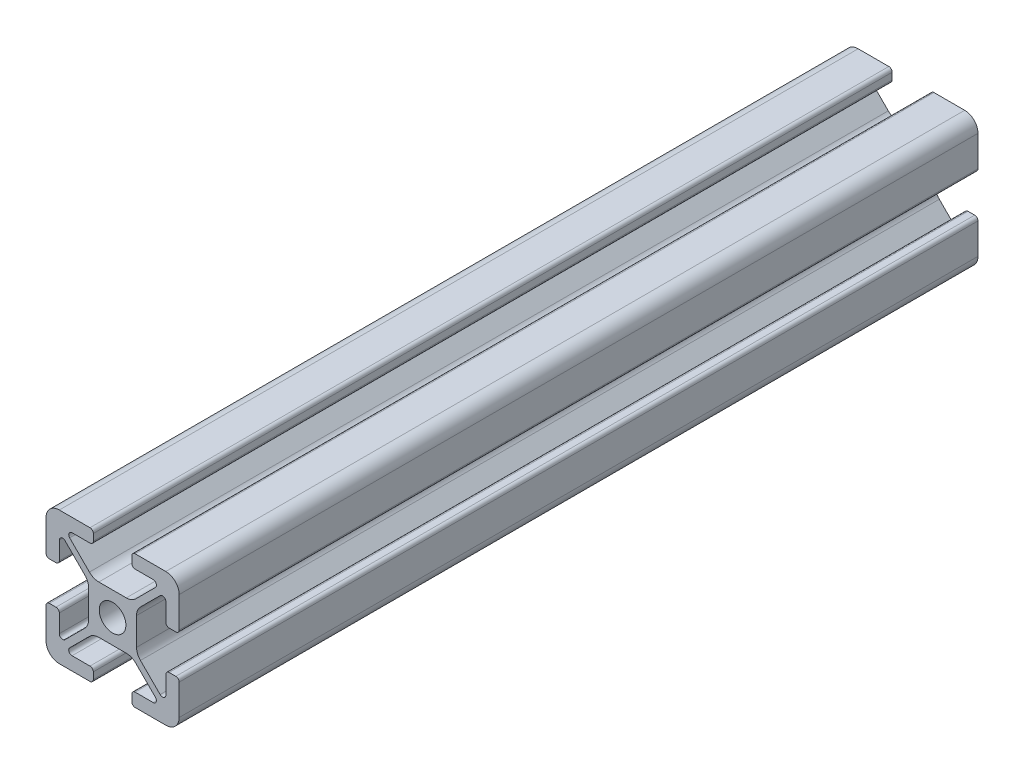
from build123d import *

# Parameters (mm, degrees)
SKETCH1_R           = 2.54
BOSS_EXTRUDE1_DEPTH = 152.4


with BuildPart() as part:
    # Sketch1 → Boss-Extrude1 (new body)
    with BuildSketch(Plane.XY):
        with BuildLine():
            Line((4.417923164, 5.315948776), (8.177961582, 9.075987194))
            ThreePointArc((8.177961582, 9.075987194), (8.315612279, 9.76800398), (7.728948776, 10.16))
            Line((7.728948776, 10.16), (4.308974388, 10.16))
            ThreePointArc((4.308974388, 10.16), (3.859961582, 10.345987194), (3.673974388, 10.795))
            Line((3.673974388, 10.795), (3.673974388, 12.065))
            ThreePointArc((3.673974388, 12.065), (3.859961582, 12.514012806), (4.308974388, 12.7))
            Line((4.308974388, 12.7), (10.16, 12.7))
            ThreePointArc((10.16, 12.7), (11.956051224, 11.956051224), (12.7, 10.16))
            Line((12.7, 10.16), (12.7, 4.308974388))
            ThreePointArc((12.7, 4.308974388), (12.514012806, 3.859961582), (12.065, 3.673974388))
            Line((12.065, 3.673974388), (10.795, 3.673974388))
            ThreePointArc((10.795, 3.673974388), (10.345987194, 3.859961582), (10.16, 4.308974388))
            Line((10.16, 4.308974388), (10.16, 7.728948776))
            ThreePointArc((10.16, 7.728948776), (9.76800398, 8.315612279), (9.075987194, 8.177961582))
            Line((9.075987194, 8.177961582), (5.315948776, 4.417923164))
            ThreePointArc((5.315948776, 4.417923164), (4.765345987, 3.593887858), (4.572, 2.621871939))
            Line((4.572, 2.621871939), (4.572, -2.621871939))
            ThreePointArc((4.572, -2.621871939), (4.765345987, -3.593887858), (5.315948776, -4.417923164))
            Line((5.315948776, -4.417923164), (9.075987194, -8.177961582))
            ThreePointArc((9.075987194, -8.177961582), (9.76800398, -8.315612279), (10.16, -7.728948776))
            Line((10.16, -7.728948776), (10.16, -4.308974388))
            ThreePointArc((10.16, -4.308974388), (10.345987194, -3.859961582), (10.795, -3.673974388))
            Line((10.795, -3.673974388), (12.065, -3.673974388))
            ThreePointArc((12.065, -3.673974388), (12.514012806, -3.859961582), (12.7, -4.308974388))
            Line((12.7, -4.308974388), (12.7, -10.16))
            ThreePointArc((12.7, -10.16), (11.956051224, -11.956051224), (10.16, -12.7))
            Line((10.16, -12.7), (4.308974388, -12.7))
            ThreePointArc((4.308974388, -12.7), (3.859961582, -12.514012806), (3.673974388, -12.065))
            Line((3.673974388, -12.065), (3.673974388, -10.795))
            ThreePointArc((3.673974388, -10.795), (3.859961582, -10.345987194), (4.308974388, -10.16))
            Line((4.308974388, -10.16), (7.728948776, -10.16))
            ThreePointArc((7.728948776, -10.16), (8.315612279, -9.76800398), (8.177961582, -9.075987194))
            Line((8.177961582, -9.075987194), (4.417923164, -5.315948776))
            ThreePointArc((4.417923164, -5.315948776), (3.593887858, -4.765345987), (2.621871939, -4.572))
            Line((2.621871939, -4.572), (-2.621871939, -4.572))
            ThreePointArc((-2.621871939, -4.572), (-3.593887858, -4.765345987), (-4.417923164, -5.315948776))
            Line((-4.417923164, -5.315948776), (-8.177961582, -9.075987194))
            ThreePointArc((-8.177961582, -9.075987194), (-8.315612279, -9.76800398), (-7.728948776, -10.16))
            Line((-7.728948776, -10.16), (-4.308974388, -10.16))
            ThreePointArc((-4.308974388, -10.16), (-3.859961582, -10.345987194), (-3.673974388, -10.795))
            Line((-3.673974388, -10.795), (-3.673974388, -12.065))
            ThreePointArc((-3.673974388, -12.065), (-3.859961582, -12.514012806), (-4.308974388, -12.7))
            Line((-4.308974388, -12.7), (-10.16, -12.7))
            ThreePointArc((-10.16, -12.7), (-11.956051224, -11.956051224), (-12.7, -10.16))
            Line((-12.7, -10.16), (-12.7, -4.308974388))
            ThreePointArc((-12.7, -4.308974388), (-12.514012806, -3.859961582), (-12.065, -3.673974388))
            Line((-12.065, -3.673974388), (-10.795, -3.673974388))
            ThreePointArc((-10.795, -3.673974388), (-10.345987194, -3.859961582), (-10.16, -4.308974388))
            Line((-10.16, -4.308974388), (-10.16, -7.728948776))
            ThreePointArc((-10.16, -7.728948776), (-9.76800398, -8.315612279), (-9.075987194, -8.177961582))
            Line((-9.075987194, -8.177961582), (-5.315948776, -4.417923164))
            ThreePointArc((-5.315948776, -4.417923164), (-4.765345987, -3.593887858), (-4.572, -2.621871939))
            Line((-4.572, -2.621871939), (-4.572, 2.621871939))
            ThreePointArc((-4.572, 2.621871939), (-4.765345987, 3.593887858), (-5.315948776, 4.417923164))
            Line((-5.315948776, 4.417923164), (-9.075987194, 8.177961582))
            ThreePointArc((-9.075987194, 8.177961582), (-9.76800398, 8.315612279), (-10.16, 7.728948776))
            Line((-10.16, 7.728948776), (-10.16, 4.308974388))
            ThreePointArc((-10.16, 4.308974388), (-10.345987194, 3.859961582), (-10.795, 3.673974388))
            Line((-10.795, 3.673974388), (-12.065, 3.673974388))
            ThreePointArc((-12.065, 3.673974388), (-12.514012806, 3.859961582), (-12.7, 4.308974388))
            Line((-12.7, 4.308974388), (-12.7, 10.16))
            ThreePointArc((-12.7, 10.16), (-11.956051224, 11.956051224), (-10.16, 12.7))
            Line((-10.16, 12.7), (-4.308974388, 12.7))
            ThreePointArc((-4.308974388, 12.7), (-3.859961582, 12.514012806), (-3.673974388, 12.065))
            Line((-3.673974388, 12.065), (-3.673974388, 10.795))
            ThreePointArc((-3.673974388, 10.795), (-3.859961582, 10.345987194), (-4.308974388, 10.16))
            Line((-4.308974388, 10.16), (-7.728948776, 10.16))
            ThreePointArc((-7.728948776, 10.16), (-8.315612279, 9.76800398), (-8.177961582, 9.075987194))
            Line((-8.177961582, 9.075987194), (-4.417923164, 5.315948776))
            ThreePointArc((-4.417923164, 5.315948776), (-3.593887858, 4.765345987), (-2.621871939, 4.572))
            Line((-2.621871939, 4.572), (2.621871939, 4.572))
            ThreePointArc((2.621871939, 4.572), (3.593887858, 4.765345987), (4.417923164, 5.315948776))
        make_face()
        with Locations(Location((0, 0, 0), (0, 0, 180))):
            Circle(SKETCH1_R, mode=Mode.SUBTRACT)
    extrude(amount=BOSS_EXTRUDE1_DEPTH)


solid = part.part
